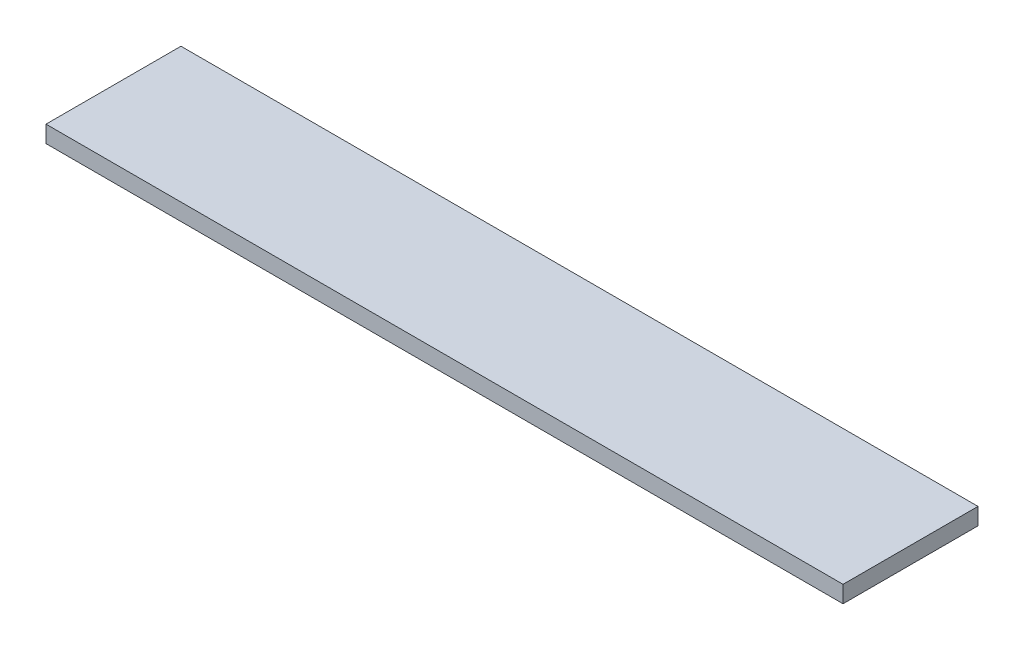
from build123d import *

# Parameters (mm, degrees)
SKETCH1_W           = 101.6
SKETCH1_H           = 12.7
BOSS_EXTRUDE1_DEPTH = 600


with BuildPart() as part:
    # Sketch1 → Boss-Extrude1 (new body)
    with BuildSketch(Plane(origin=(0, 0, 0), x_dir=(0, 0, -1), z_dir=(1, 0, 0))):
        with Locations((50.8, 6.35)):
            Rectangle(SKETCH1_W, SKETCH1_H)
    extrude(amount=BOSS_EXTRUDE1_DEPTH)


solid = part.part
